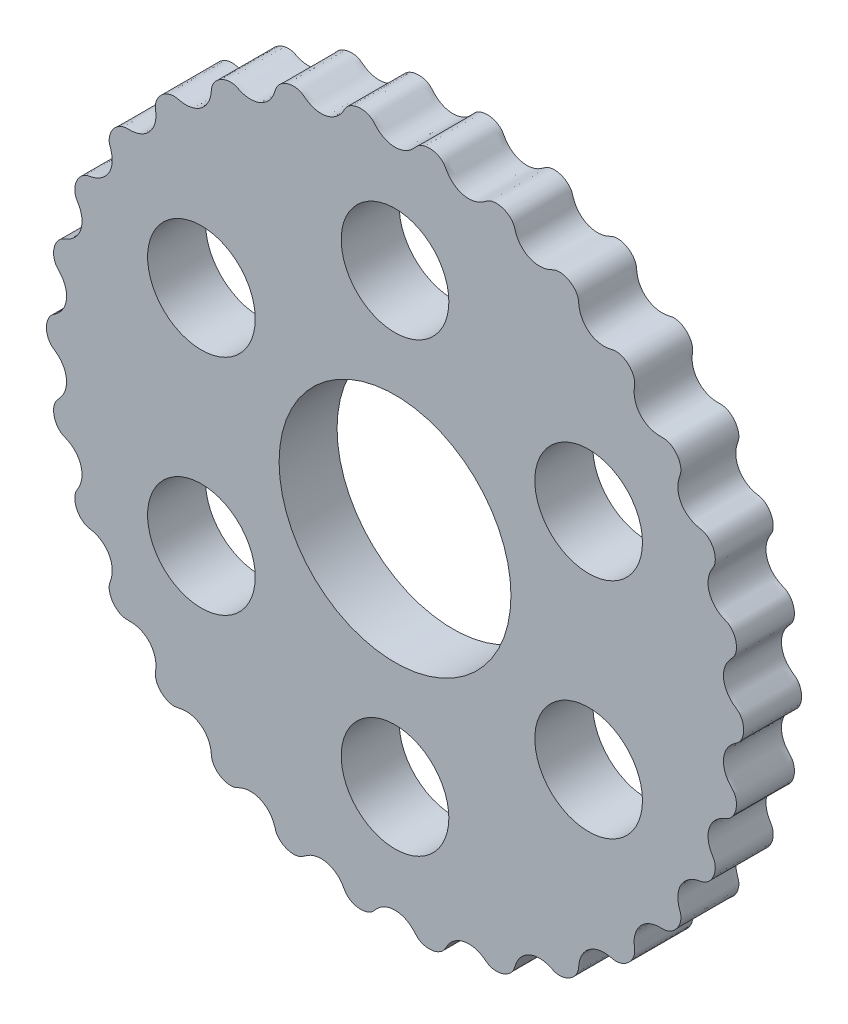
from build123d import *

# Parameters (mm, degrees)
BOSS_EXTRUDE1_DEPTH = 7
SKETCH2_R           = 14
SKETCH2_R_2         = 6.5
CUT_EXTRUDE1_DEPTH  = 7


with BuildPart() as part:
    # Sketch1 → Boss-Extrude1 (new body)
    with BuildSketch(Plane.XY):
        with BuildLine():
            add(Edge.make_bspline(
                [(0, 39.9), (-0.645065656, 39.9), (-1.539322366, 40.21259767), (-2.250661944, 40.881063376), (-2.506109766, 41.17643793), (-2.635737516, 41.318729318), (-2.747665644, 41.423428715), (-2.879288756, 41.524641158), (-3.046510521, 41.62716893), (-3.25481797, 41.724783596), (-3.502815797, 41.807416311), (-3.783910569, 41.864978672), (-4.087704244, 41.889350868), (-4.401331857, 41.875849776), (-4.710909524, 41.823849264), (-5.002990698, 41.736835229), (-5.265981079, 41.622111101), (-5.491369264, 41.489704359), (-5.674838528, 41.350927505), (-5.817080557, 41.215861536), (-5.924804258, 41.089510725), (-6.012501742, 40.963814005), (-6.109722065, 40.797685857), (-6.298161469, 40.455643023), (-6.855003789, 39.653906965), (-8.248790197, 38.807526858), (-9.866354979, 39.013810855), (-10.701125029, 39.519783186), (-11.012414893, 39.755581009), (-11.168788294, 39.867822582), (-11.300041805, 39.946952834), (-11.449825439, 40.018597491), (-11.634718196, 40.08410004), (-11.858762801, 40.136290095), (-12.118524387, 40.165548674), (-12.405441516, 40.163402985), (-12.707664161, 40.124080566), (-13.011633568, 40.045683329), (-13.303626541, 39.930433411), (-13.571245435, 39.784614233), (-13.804635676, 39.61771081), (-13.997570247, 39.441334708), (-14.148176904, 39.267447692), (-14.259219074, 39.105753536), (-14.338320877, 38.959771144), (-14.397972865, 38.818590868), (-14.458517255, 38.635876054), (-14.57173638, 38.262133975), (-14.949697776, 37.36213283), (-16.137075297, 36.244458295), (-17.76217422, 36.10994728), (-18.683914445, 36.431272599), (-19.037415713, 36.597220052), (-19.213710091, 36.674489778), (-19.358545148, 36.724616417), (-19.519957346, 36.763524699), (-19.71442148, 36.789181202), (-19.944421065, 36.793628474), (-20.204591891, 36.768266877), (-20.484792947, 36.70649882), (-20.772236961, 36.605206851), (-21.053257479, 36.465313517), (-21.31491952, 36.291891843), (-21.546358803, 36.093599466), (-21.739952457, 35.881824514), (-21.892011309, 35.669193988), (-22.003164368, 35.467784778), (-22.078160592, 35.286535354), (-22.125185799, 35.127300283), (-22.154176886, 34.976803786), (-22.17541159, 34.785496216), (-22.208458239, 34.396382144), (-22.391041383, 33.437469624), (-23.320088647, 32.097352524), (-24.881705606, 31.627887621), (-25.850108758, 31.750561808), (-26.230388037, 31.839381536), (-26.418897116, 31.878307067), (-26.570988313, 31.897225393), (-26.736963698, 31.901726756), (-26.932514543, 31.886390909), (-27.158416502, 31.842923227), (-27.40762672, 31.764018058), (-27.668861974, 31.645343711), (-27.928964765, 31.486505932), (-28.17476468, 31.291242907), (-28.394641964, 31.067196932), (-28.579812316, 30.825131227), (-28.725129872, 30.577727341), (-28.829660806, 30.338134924), (-28.896505906, 30.118017319), (-28.932194019, 29.92513997), (-28.945063874, 29.759600758), (-28.942139417, 29.606365185), (-28.923140382, 29.414820972), (-28.874558569, 29.027342423), (-28.853778643, 28.051420212), (-29.483904149, 26.547423861), (-30.913792841, 25.763558971), (-31.886537493, 25.68219601), (-32.276973695, 25.690019263), (-32.469455966, 25.688883899), (-32.622158066, 25.675777245), (-32.785443032, 25.645672193), (-32.973532589, 25.590018321), (-33.185456683, 25.500526365), (-33.41281234, 25.371528105), (-33.643672432, 25.201144828), (-33.865053016, 24.991683872), (-34.064895261, 24.749594568), (-34.233390476, 24.4847284), (-34.36417867, 24.209449928), (-34.454885235, 23.937239412), (-34.507315294, 23.68114744), (-34.526932968, 23.451941305), (-34.521734957, 23.255858581), (-34.499918722, 23.091263998), (-34.465198505, 22.941982769), (-34.406781509, 22.75857723), (-34.278702887, 22.389660541), (-34.055485298, 21.439387314), (-34.359122718, 19.837251543), (-35.594791887, 18.773218529), (-36.529367172, 18.491399145), (-36.912896703, 18.417864829), (-37.100941286, 18.376749821), (-37.247578485, 18.332169721), (-37.401037783, 18.268778664), (-37.573446012, 18.175233002), (-37.762127708, 18.043627929), (-37.957703107, 17.870186636), (-38.148086637, 17.655523843), (-38.321089599, 17.404619687), (-38.466210859, 17.126261707), (-38.575970714, 16.832159585), (-38.646654148, 16.535702104), (-38.678801265, 16.25058074), (-38.676823391, 15.989183384), (-38.64836856, 15.760907687), (-38.602526294, 15.570187116), (-38.546950564, 15.413728356), (-38.481960422, 15.274925823), (-38.386679186, 15.107678383), (-38.1847142, 14.773446158), (-37.768761219, 13.890363272), (-37.732713418, 12.260095212), (-38.720133718, 10.962403061), (-39.575691635, 10.492428495), (-39.935552945, 10.340764095), (-40.110936347, 10.261447836), (-40.245105829, 10.187368091), (-40.382020554, 10.093442657), (-40.531222943, 9.966108479), (-40.688414586, 9.798142648), (-40.843653797, 9.58782746), (-40.985249194, 9.338272015), (-41.102315758, 9.056884351), (-41.186379539, 8.754433457), (-41.232599694, 8.443939281), (-41.240099192, 8.139263057), (-41.212255262, 7.853692856), (-41.155988443, 7.598417652), (-41.080689119, 7.381046104), (-40.996194035, 7.204027919), (-40.90930649, 7.062538221), (-40.816874645, 6.940283846), (-40.688900553, 6.79650201), (-40.421864174, 6.511558246), (-39.831391771, 5.734262977), (-39.457164103, 4.147109167), (-40.153224222, 2.672487162), (-40.892366308, 2.034896764), (-41.212828887, 1.81172449), (-41.367887329, 1.697678155), (-41.483730579, 1.597327166), (-41.598119933, 1.476979031), (-41.717587823, 1.32140594), (-41.836424033, 1.12443269), (-41.944548556, 0.886440322), (-42.031163077, 0.612898322), (-42.087153039, 0.313316383), (-42.106518845, 0), (-42.087153039, -0.313316383), (-42.031163077, -0.612898322), (-41.944548556, -0.886440322), (-41.836424033, -1.12443269), (-41.717587823, -1.32140594), (-41.598119933, -1.476979031), (-41.483730579, -1.597327166), (-41.367887329, -1.697678155), (-41.212828887, -1.81172449), (-40.892366308, -2.034896764), (-40.153224222, -2.672487162), (-39.457164103, -4.147109167), (-39.831391771, -5.734262977), (-40.421864174, -6.511558246), (-40.688900553, -6.79650201), (-40.816874645, -6.940283846), (-40.90930649, -7.062538221), (-40.996194035, -7.204027919), (-41.080689119, -7.381046104), (-41.155988443, -7.598417652), (-41.212255262, -7.853692856), (-41.240099192, -8.139263057), (-41.232599694, -8.443939281), (-41.186379539, -8.754433457), (-41.102315758, -9.056884351), (-40.985249194, -9.338272015), (-40.843653797, -9.58782746), (-40.688414586, -9.798142648), (-40.531222943, -9.966108479), (-40.382020554, -10.093442657), (-40.245105829, -10.187368091), (-40.110936347, -10.261447836), (-39.935552945, -10.340764095), (-39.575691635, -10.492428495), (-38.720133718, -10.962403061), (-37.732713418, -12.260095212), (-37.768761219, -13.890363272), (-38.1847142, -14.773446158), (-38.386679186, -15.107678383), (-38.481960422, -15.274925823), (-38.546950564, -15.413728356), (-38.602526294, -15.570187116), (-38.64836856, -15.760907687), (-38.676823391, -15.989183384), (-38.678801265, -16.25058074), (-38.646654148, -16.535702104), (-38.575970714, -16.832159585), (-38.466210859, -17.126261707), (-38.321089599, -17.404619687), (-38.148086637, -17.655523843), (-37.957703107, -17.870186636), (-37.762127708, -18.043627929), (-37.573446012, -18.175233002), (-37.401037783, -18.268778664), (-37.247578485, -18.332169721), (-37.100941286, -18.376749821), (-36.912896703, -18.417864829), (-36.529367172, -18.491399145), (-35.594791887, -18.773218529), (-34.359122718, -19.837251543), (-34.055485298, -21.439387314), (-34.278702887, -22.389660541), (-34.406781509, -22.75857723), (-34.465198505, -22.941982769), (-34.499918722, -23.091263998), (-34.521734957, -23.255858581), (-34.526932968, -23.451941305), (-34.507315294, -23.68114744), (-34.454885235, -23.937239412), (-34.36417867, -24.209449928), (-34.233390476, -24.4847284), (-34.064895261, -24.749594568), (-33.865053016, -24.991683872), (-33.643672432, -25.201144828), (-33.41281234, -25.371528105), (-33.185456683, -25.500526365), (-32.973532589, -25.590018321), (-32.785443032, -25.645672193), (-32.622158066, -25.675777245), (-32.469455966, -25.688883899), (-32.276973695, -25.690019263), (-31.886537493, -25.68219601), (-30.913792841, -25.763558971), (-29.483904149, -26.547423861), (-28.853778643, -28.051420212), (-28.874558569, -29.027342423), (-28.923140382, -29.414820972), (-28.942139417, -29.606365185), (-28.945063874, -29.759600758), (-28.932194019, -29.92513997), (-28.896505906, -30.118017319), (-28.829660806, -30.338134924), (-28.725129872, -30.577727341), (-28.579812316, -30.825131227), (-28.394641964, -31.067196932), (-28.17476468, -31.291242907), (-27.928964765, -31.486505932), (-27.668861974, -31.645343711), (-27.40762672, -31.764018058), (-27.158416502, -31.842923227), (-26.932514543, -31.886390909), (-26.736963698, -31.901726756), (-26.570988313, -31.897225393), (-26.418897116, -31.878307067), (-26.230388037, -31.839381536), (-25.850108758, -31.750561808), (-24.881705606, -31.627887621), (-23.320088647, -32.097352524), (-22.391041383, -33.437469624), (-22.208458239, -34.396382144), (-22.17541159, -34.785496216), (-22.154176886, -34.976803786), (-22.125185799, -35.127300283), (-22.078160592, -35.286535354), (-22.003164368, -35.467784778), (-21.892011309, -35.669193988), (-21.739952457, -35.881824514), (-21.546358803, -36.093599466), (-21.31491952, -36.291891843), (-21.053257479, -36.465313517), (-20.772236961, -36.605206851), (-20.484792947, -36.70649882), (-20.204591891, -36.768266877), (-19.944421065, -36.793628474), (-19.71442148, -36.789181202), (-19.519957346, -36.763524699), (-19.358545148, -36.724616417), (-19.213710091, -36.674489778), (-19.037415713, -36.597220052), (-18.683914445, -36.431272599), (-17.76217422, -36.10994728), (-16.137075297, -36.244458295), (-14.949697776, -37.36213283), (-14.57173638, -38.262133975), (-14.458517255, -38.635876054), (-14.397972865, -38.818590868), (-14.338320877, -38.959771144), (-14.259219074, -39.105753536), (-14.148176904, -39.267447692), (-13.997570247, -39.441334708), (-13.804635676, -39.61771081), (-13.571245435, -39.784614233), (-13.303626541, -39.930433411), (-13.011633568, -40.045683329), (-12.707664161, -40.124080566), (-12.405441516, -40.163402985), (-12.118524387, -40.165548674), (-11.858762801, -40.136290095), (-11.634718196, -40.08410004), (-11.449825439, -40.018597491), (-11.300041805, -39.946952834), (-11.168788294, -39.867822582), (-11.012414893, -39.755581009), (-10.701125029, -39.519783186), (-9.866354979, -39.013810855), (-8.248790197, -38.807526858), (-6.855003789, -39.653906965), (-6.298161469, -40.455643023), (-6.109722065, -40.797685857), (-6.012501742, -40.963814005), (-5.924804258, -41.089510725), (-5.817080557, -41.215861536), (-5.674838528, -41.350927505), (-5.491369264, -41.489704359), (-5.265981079, -41.622111101), (-5.002990698, -41.736835229), (-4.710909524, -41.823849264), (-4.401331857, -41.875849776), (-4.087704244, -41.889350868), (-3.783910569, -41.864978672), (-3.502815797, -41.807416311), (-3.25481797, -41.724783596), (-3.046510521, -41.62716893), (-2.879288756, -41.524641158), (-2.747665644, -41.423428715), (-2.635737516, -41.318729318), (-2.506109766, -41.17643793), (-2.250661944, -40.881063376), (-1.539322366, -40.21259767), (0, -39.674509916), (1.539322366, -40.21259767), (2.250661944, -40.881063376), (2.506109766, -41.17643793), (2.635737516, -41.318729318), (2.747665644, -41.423428715), (2.879288756, -41.524641158), (3.046510521, -41.62716893), (3.25481797, -41.724783596), (3.502815797, -41.807416311), (3.783910569, -41.864978672), (4.087704244, -41.889350868), (4.401331857, -41.875849776), (4.710909524, -41.823849264), (5.002990698, -41.736835229), (5.265981079, -41.622111101), (5.491369264, -41.489704359), (5.674838528, -41.350927505), (5.817080557, -41.215861536), (5.924804258, -41.089510725), (6.012501742, -40.963814005), (6.109722065, -40.797685857), (6.298161469, -40.455643023), (6.855003789, -39.653906965), (8.248790197, -38.807526858), (9.866354979, -39.013810855), (10.701125029, -39.519783186), (11.012414893, -39.755581009), (11.168788294, -39.867822582), (11.300041805, -39.946952834), (11.449825439, -40.018597491), (11.634718196, -40.08410004), (11.858762801, -40.136290095), (12.118524387, -40.165548674), (12.405441516, -40.163402985), (12.707664161, -40.124080566), (13.011633568, -40.045683329), (13.303626541, -39.930433411), (13.571245435, -39.784614233), (13.804635676, -39.61771081), (13.997570247, -39.441334708), (14.148176904, -39.267447692), (14.259219074, -39.105753536), (14.338320877, -38.959771144), (14.397972865, -38.818590868), (14.458517255, -38.635876054), (14.57173638, -38.262133975), (14.949697776, -37.36213283), (16.137075297, -36.244458295), (17.76217422, -36.10994728), (18.683914445, -36.431272599), (19.037415713, -36.597220052), (19.213710091, -36.674489778), (19.358545148, -36.724616417), (19.519957346, -36.763524699), (19.71442148, -36.789181202), (19.944421065, -36.793628474), (20.204591891, -36.768266877), (20.484792947, -36.70649882), (20.772236961, -36.605206851), (21.053257479, -36.465313517), (21.31491952, -36.291891843), (21.546358803, -36.093599466), (21.739952457, -35.881824514), (21.892011309, -35.669193988), (22.003164368, -35.467784778), (22.078160592, -35.286535354), (22.125185799, -35.127300283), (22.154176886, -34.976803786), (22.17541159, -34.785496216), (22.208458239, -34.396382144), (22.391041383, -33.437469624), (23.320088647, -32.097352524), (24.881705606, -31.627887621), (25.850108758, -31.750561808), (26.230388037, -31.839381536), (26.418897116, -31.878307067), (26.570988313, -31.897225393), (26.736963698, -31.901726756), (26.932514543, -31.886390909), (27.158416502, -31.842923227), (27.40762672, -31.764018058), (27.668861974, -31.645343711), (27.928964765, -31.486505932), (28.17476468, -31.291242907), (28.394641964, -31.067196932), (28.579812316, -30.825131227), (28.725129872, -30.577727341), (28.829660806, -30.338134924), (28.896505906, -30.118017319), (28.932194019, -29.92513997), (28.945063874, -29.759600758), (28.942139417, -29.606365185), (28.923140382, -29.414820972), (28.874558569, -29.027342423), (28.853778643, -28.051420212), (29.483904149, -26.547423861), (30.913792841, -25.763558971), (31.886537493, -25.68219601), (32.276973695, -25.690019263), (32.469455966, -25.688883899), (32.622158066, -25.675777245), (32.785443032, -25.645672193), (32.973532589, -25.590018321), (33.185456683, -25.500526365), (33.41281234, -25.371528105), (33.643672432, -25.201144828), (33.865053016, -24.991683872), (34.064895261, -24.749594568), (34.233390476, -24.4847284), (34.36417867, -24.209449928), (34.454885235, -23.937239412), (34.507315294, -23.68114744), (34.526932968, -23.451941305), (34.521734957, -23.255858581), (34.499918722, -23.091263998), (34.465198505, -22.941982769), (34.406781509, -22.75857723), (34.278702887, -22.389660541), (34.055485298, -21.439387314), (34.359122718, -19.837251543), (35.594791887, -18.773218529), (36.529367172, -18.491399145), (36.912896703, -18.417864829), (37.100941286, -18.376749821), (37.247578485, -18.332169721), (37.401037783, -18.268778664), (37.573446012, -18.175233002), (37.762127708, -18.043627929), (37.957703107, -17.870186636), (38.148086637, -17.655523843), (38.321089599, -17.404619687), (38.466210859, -17.126261707), (38.575970714, -16.832159585), (38.646654148, -16.535702104), (38.678801265, -16.25058074), (38.676823391, -15.989183384), (38.64836856, -15.760907687), (38.602526294, -15.570187116), (38.546950564, -15.413728356), (38.481960422, -15.274925823), (38.386679186, -15.107678383), (38.1847142, -14.773446158), (37.768761219, -13.890363272), (37.732713418, -12.260095212), (38.720133718, -10.962403061), (39.575691635, -10.492428495), (39.935552945, -10.340764095), (40.110936347, -10.261447836), (40.245105829, -10.187368091), (40.382020554, -10.093442657), (40.531222943, -9.966108479), (40.688414586, -9.798142648), (40.843653797, -9.58782746), (40.985249194, -9.338272015), (41.102315758, -9.056884351), (41.186379539, -8.754433457), (41.232599694, -8.443939281), (41.240099192, -8.139263057), (41.212255262, -7.853692856), (41.155988443, -7.598417652), (41.080689119, -7.381046104), (40.996194035, -7.204027919), (40.90930649, -7.062538221), (40.816874645, -6.940283846), (40.688900553, -6.79650201), (40.421864174, -6.511558246), (39.831391771, -5.734262977), (39.457164103, -4.147109167), (40.153224222, -2.672487162), (40.892366308, -2.034896764), (41.212828887, -1.81172449), (41.367887329, -1.697678155), (41.483730579, -1.597327166), (41.598119933, -1.476979031), (41.717587823, -1.32140594), (41.836424033, -1.12443269), (41.944548556, -0.886440322), (42.031163077, -0.612898322), (42.087153039, -0.313316383), (42.106518845, 0), (42.087153039, 0.313316383), (42.031163077, 0.612898322), (41.944548556, 0.886440322), (41.836424033, 1.12443269), (41.717587823, 1.32140594), (41.598119933, 1.476979031), (41.483730579, 1.597327166), (41.367887329, 1.697678155), (41.212828887, 1.81172449), (40.892366308, 2.034896764), (40.153224222, 2.672487162), (39.457164103, 4.147109167), (39.831391771, 5.734262977), (40.421864174, 6.511558246), (40.688900553, 6.79650201), (40.816874645, 6.940283846), (40.90930649, 7.062538221), (40.996194035, 7.204027919), (41.080689119, 7.381046104), (41.155988443, 7.598417652), (41.212255262, 7.853692856), (41.240099192, 8.139263057), (41.232599694, 8.443939281), (41.186379539, 8.754433457), (41.102315758, 9.056884351), (40.985249194, 9.338272015), (40.843653797, 9.58782746), (40.688414586, 9.798142648), (40.531222943, 9.966108479), (40.382020554, 10.093442657), (40.245105829, 10.187368091), (40.110936347, 10.261447836), (39.935552945, 10.340764095), (39.575691635, 10.492428495), (38.720133718, 10.962403061), (37.732713418, 12.260095212), (37.768761219, 13.890363272), (38.1847142, 14.773446158), (38.386679186, 15.107678383), (38.481960422, 15.274925823), (38.546950564, 15.413728356), (38.602526294, 15.570187116), (38.64836856, 15.760907687), (38.676823391, 15.989183384), (38.678801265, 16.25058074), (38.646654148, 16.535702104), (38.575970714, 16.832159585), (38.466210859, 17.126261707), (38.321089599, 17.404619687), (38.148086637, 17.655523843), (37.957703107, 17.870186636), (37.762127708, 18.043627929), (37.573446012, 18.175233002), (37.401037783, 18.268778664), (37.247578485, 18.332169721), (37.100941286, 18.376749821), (36.912896703, 18.417864829), (36.529367172, 18.491399145), (35.594791887, 18.773218529), (34.359122718, 19.837251543), (34.055485298, 21.439387314), (34.278702887, 22.389660541), (34.406781509, 22.75857723), (34.465198505, 22.941982769), (34.499918722, 23.091263998), (34.521734957, 23.255858581), (34.526932968, 23.451941305), (34.507315294, 23.68114744), (34.454885235, 23.937239412), (34.36417867, 24.209449928), (34.233390476, 24.4847284), (34.064895261, 24.749594568), (33.865053016, 24.991683872), (33.643672432, 25.201144828), (33.41281234, 25.371528105), (33.185456683, 25.500526365), (32.973532589, 25.590018321), (32.785443032, 25.645672193), (32.622158066, 25.675777245), (32.469455966, 25.688883899), (32.276973695, 25.690019263), (31.886537493, 25.68219601), (30.913792841, 25.763558971), (29.483904149, 26.547423861), (28.853778643, 28.051420212), (28.874558569, 29.027342423), (28.923140382, 29.414820972), (28.942139417, 29.606365185), (28.945063874, 29.759600758), (28.932194019, 29.92513997), (28.896505906, 30.118017319), (28.829660806, 30.338134924), (28.725129872, 30.577727341), (28.579812316, 30.825131227), (28.394641964, 31.067196932), (28.17476468, 31.291242907), (27.928964765, 31.486505932), (27.668861974, 31.645343711), (27.40762672, 31.764018058), (27.158416502, 31.842923227), (26.932514543, 31.886390909), (26.736963698, 31.901726756), (26.570988313, 31.897225393), (26.418897116, 31.878307067), (26.230388037, 31.839381536), (25.850108758, 31.750561808), (24.881705606, 31.627887621), (23.320088647, 32.097352524), (22.391041383, 33.437469624), (22.208458239, 34.396382144), (22.17541159, 34.785496216), (22.154176886, 34.976803786), (22.125185799, 35.127300283), (22.078160592, 35.286535354), (22.003164368, 35.467784778), (21.892011309, 35.669193988), (21.739952457, 35.881824514), (21.546358803, 36.093599466), (21.31491952, 36.291891843), (21.053257479, 36.465313517), (20.772236961, 36.605206851), (20.484792947, 36.70649882), (20.204591891, 36.768266877), (19.944421065, 36.793628474), (19.71442148, 36.789181202), (19.519957346, 36.763524699), (19.358545148, 36.724616417), (19.213710091, 36.674489778), (19.037415713, 36.597220052), (18.683914445, 36.431272599), (17.76217422, 36.10994728), (16.137075297, 36.244458295), (14.949697776, 37.36213283), (14.57173638, 38.262133975), (14.458517255, 38.635876054), (14.397972865, 38.818590868), (14.338320877, 38.959771144), (14.259219074, 39.105753536), (14.148176904, 39.267447692), (13.997570247, 39.441334708), (13.804635676, 39.61771081), (13.571245435, 39.784614233), (13.303626541, 39.930433411), (13.011633568, 40.045683329), (12.707664161, 40.124080566), (12.405441516, 40.163402985), (12.118524387, 40.165548674), (11.858762801, 40.136290095), (11.634718196, 40.08410004), (11.449825439, 40.018597491), (11.300041805, 39.946952834), (11.168788294, 39.867822582), (11.012414893, 39.755581009), (10.701125029, 39.519783186), (9.866354979, 39.013810855), (8.248790197, 38.807526858), (6.855003789, 39.653906965), (6.298161469, 40.455643023), (6.109722065, 40.797685857), (6.012501742, 40.963814005), (5.924804258, 41.089510725), (5.817080557, 41.215861536), (5.674838528, 41.350927505), (5.491369264, 41.489704359), (5.265981079, 41.622111101), (5.002990698, 41.736835229), (4.710909524, 41.823849264), (4.401331857, 41.875849776), (4.087704244, 41.889350868), (3.783910569, 41.864978672), (3.502815797, 41.807416311), (3.25481797, 41.724783596), (3.046510521, 41.62716893), (2.879288756, 41.524641158), (2.747665644, 41.423428715), (2.635737516, 41.318729318), (2.506109766, 41.17643793), (2.250661944, 40.881063376), (1.539322366, 40.21259767), (0.645065656, 39.9), (0, 39.9)],
                knots=[0, 0, 0, 0, 0.006371359, 0.008832637, 0.00976874, 0.010294619, 0.010765553, 0.011306507, 0.011959876, 0.012732252, 0.013612556, 0.014579861, 0.015607782, 0.016666672, 0.017725572, 0.018753447, 0.019720772, 0.020601057, 0.021373441, 0.022026805, 0.022567777, 0.023038705, 0.023564588, 0.024500704, 0.026961993, 0.033333337, 0.039704665, 0.042165947, 0.043102088, 0.043627959, 0.044098875, 0.044639831, 0.045293199, 0.046065595, 0.046945871, 0.047913193, 0.048941099, 0.049999998, 0.051058877, 0.052086769, 0.053054108, 0.05393439, 0.054706786, 0.055360116, 0.055901105, 0.056372025, 0.056897887, 0.05783403, 0.060295305, 0.066666665, 0.073038032, 0.075499311, 0.076435428, 0.076961314, 0.077432232, 0.077973191, 0.078626546, 0.079398924, 0.080279219, 0.081246546, 0.082274451, 0.083333339, 0.084392221, 0.085420113, 0.086387457, 0.087267738, 0.088040147, 0.088693496, 0.089234469, 0.089705361, 0.090231249, 0.091167374, 0.093628642, 0.099999997, 0.106371359, 0.108832623, 0.109768753, 0.110294636, 0.110765558, 0.111306508, 0.111959878, 0.112732269, 0.113612569, 0.114579871, 0.115607791, 0.116666671, 0.117725579, 0.118753468, 0.119720785, 0.12060107, 0.121373459, 0.122026816, 0.122567782, 0.123038723, 0.123564575, 0.1245007, 0.126961979, 0.13333335, 0.139704692, 0.14216596, 0.143102098, 0.143627968, 0.144098895, 0.144639858, 0.145293214, 0.146065599, 0.146945904, 0.147913205, 0.148941103, 0.150000011, 0.151058905, 0.152086804, 0.153054125, 0.153934404, 0.154706808, 0.15536016, 0.155901124, 0.156372027, 0.156897938, 0.157834042, 0.160295333, 0.166666667, 0.173038006, 0.175499293, 0.176435429, 0.176961295, 0.177432237, 0.177973193, 0.178626542, 0.179398944, 0.180279245, 0.181246541, 0.182274434, 0.183333341, 0.184392231, 0.185420113, 0.186387447, 0.187267752, 0.188040123, 0.188693476, 0.189234471, 0.189705364, 0.190231239, 0.191167388, 0.193628643, 0.2, 0.206371362, 0.208832613, 0.209768758, 0.210294648, 0.21076554, 0.211306498, 0.211959877, 0.212732253, 0.213612563, 0.214579883, 0.215607766, 0.216666666, 0.21772557, 0.218753446, 0.219720774, 0.220601064, 0.221373435, 0.222026817, 0.222567762, 0.223038698, 0.223564575, 0.22450069, 0.226961982, 0.23333332, 0.239704679, 0.242165976, 0.243102077, 0.243627961, 0.244098888, 0.244639839, 0.245293217, 0.246065611, 0.246945877, 0.247913216, 0.248941118, 0.25, 0.251058882, 0.252086784, 0.253054123, 0.253934389, 0.254706783, 0.255360161, 0.255901112, 0.256372039, 0.256897923, 0.257834024, 0.260295321, 0.26666668, 0.273038018, 0.27549931, 0.276435425, 0.276961302, 0.277432238, 0.277973183, 0.278626565, 0.279398936, 0.280279226, 0.281246554, 0.28227443, 0.283333334, 0.284392234, 0.285420117, 0.286387437, 0.287267747, 0.288040123, 0.288693502, 0.28923446, 0.289705352, 0.290231242, 0.291167387, 0.293628638, 0.3, 0.306371357, 0.308832612, 0.309768761, 0.310294636, 0.310765529, 0.311306524, 0.311959877, 0.312732248, 0.313612553, 0.314579887, 0.315607769, 0.316666659, 0.317725566, 0.318753459, 0.319720755, 0.320601056, 0.321373458, 0.322026807, 0.322567763, 0.323038705, 0.323564571, 0.324500707, 0.326961994, 0.333333333, 0.339704667, 0.342165958, 0.343102062, 0.343627973, 0.344098876, 0.34463984, 0.345293192, 0.346065596, 0.346945875, 0.347913196, 0.348941095, 0.349999989, 0.351058897, 0.352086795, 0.353054096, 0.353934401, 0.354706786, 0.355360142, 0.355901105, 0.356372032, 0.356897902, 0.35783404, 0.360295308, 0.36666665, 0.373038021, 0.3754993, 0.376435425, 0.376961277, 0.377432218, 0.377973184, 0.378626541, 0.37939893, 0.380279215, 0.381246532, 0.382274421, 0.383333329, 0.384392209, 0.385420129, 0.386387431, 0.387267731, 0.388040122, 0.388693492, 0.389234442, 0.389705364, 0.390231247, 0.391167377, 0.393628641, 0.400000003, 0.406371358, 0.408832626, 0.409768751, 0.410294639, 0.410765531, 0.411306504, 0.411959853, 0.412732262, 0.413612543, 0.414579887, 0.415607779, 0.416666661, 0.417725549, 0.418753454, 0.419720781, 0.420601076, 0.421373454, 0.422026809, 0.422567768, 0.423038686, 0.423564572, 0.424500689, 0.426961968, 0.433333335, 0.439704695, 0.44216597, 0.443102113, 0.443627975, 0.444098895, 0.444639884, 0.445293214, 0.44606561, 0.446945892, 0.447913231, 0.448941123, 0.450000002, 0.451058901, 0.452086807, 0.453054129, 0.453934405, 0.454706801, 0.455360169, 0.455901125, 0.456372041, 0.456897912, 0.457834053, 0.460295335, 0.466666663, 0.473038007, 0.475499296, 0.476435412, 0.476961295, 0.477432223, 0.477973195, 0.478626559, 0.479398943, 0.480279228, 0.481246553, 0.482274428, 0.483333328, 0.484392218, 0.485420139, 0.486387444, 0.487267748, 0.488040124, 0.488693493, 0.489234447, 0.489705381, 0.49023126, 0.491167363, 0.493628641, 0.5, 0.506371359, 0.508832637, 0.50976874, 0.510294619, 0.510765553, 0.511306507, 0.511959876, 0.512732252, 0.513612556, 0.514579861, 0.515607782, 0.516666672, 0.517725572, 0.518753447, 0.519720772, 0.520601057, 0.521373441, 0.522026805, 0.522567777, 0.523038705, 0.523564588, 0.524500704, 0.526961993, 0.533333337, 0.539704665, 0.542165947, 0.543102088, 0.543627959, 0.544098875, 0.544639831, 0.545293199, 0.546065595, 0.546945871, 0.547913193, 0.548941099, 0.549999998, 0.551058877, 0.552086769, 0.553054108, 0.55393439, 0.554706786, 0.555360116, 0.555901105, 0.556372025, 0.556897887, 0.55783403, 0.560295305, 0.566666665, 0.573038032, 0.575499311, 0.576435428, 0.576961314, 0.577432232, 0.577973191, 0.578626546, 0.579398924, 0.580279219, 0.581246546, 0.582274451, 0.583333339, 0.584392221, 0.585420113, 0.586387457, 0.587267738, 0.588040147, 0.588693496, 0.589234469, 0.589705361, 0.590231249, 0.591167374, 0.593628642, 0.599999997, 0.606371359, 0.608832623, 0.609768753, 0.610294636, 0.610765558, 0.611306508, 0.611959878, 0.612732269, 0.613612569, 0.614579871, 0.615607791, 0.616666671, 0.617725579, 0.618753468, 0.619720785, 0.62060107, 0.621373459, 0.622026816, 0.622567782, 0.623038723, 0.623564575, 0.6245007, 0.626961979, 0.63333335, 0.639704692, 0.64216596, 0.643102098, 0.643627968, 0.644098895, 0.644639858, 0.645293214, 0.646065599, 0.646945904, 0.647913205, 0.648941103, 0.650000011, 0.651058905, 0.652086804, 0.653054125, 0.653934404, 0.654706808, 0.65536016, 0.655901124, 0.656372027, 0.656897938, 0.657834042, 0.660295333, 0.666666667, 0.673038006, 0.675499293, 0.676435429, 0.676961295, 0.677432237, 0.677973193, 0.678626542, 0.679398944, 0.680279245, 0.681246541, 0.682274434, 0.683333341, 0.684392231, 0.685420113, 0.686387447, 0.687267752, 0.688040123, 0.688693476, 0.689234471, 0.689705364, 0.690231239, 0.691167388, 0.693628643, 0.7, 0.706371362, 0.708832613, 0.709768758, 0.710294648, 0.71076554, 0.711306498, 0.711959877, 0.712732253, 0.713612563, 0.714579883, 0.715607766, 0.716666666, 0.71772557, 0.718753446, 0.719720774, 0.720601064, 0.721373435, 0.722026817, 0.722567762, 0.723038698, 0.723564575, 0.72450069, 0.726961982, 0.73333332, 0.739704679, 0.742165976, 0.743102077, 0.743627961, 0.744098888, 0.744639839, 0.745293217, 0.746065611, 0.746945877, 0.747913216, 0.748941118, 0.75, 0.751058882, 0.752086784, 0.753054123, 0.753934389, 0.754706783, 0.755360161, 0.755901112, 0.756372039, 0.756897923, 0.757834024, 0.760295321, 0.76666668, 0.773038018, 0.77549931, 0.776435425, 0.776961302, 0.777432238, 0.777973183, 0.778626565, 0.779398936, 0.780279226, 0.781246554, 0.78227443, 0.783333334, 0.784392234, 0.785420117, 0.786387437, 0.787267747, 0.788040123, 0.788693502, 0.78923446, 0.789705352, 0.790231242, 0.791167387, 0.793628638, 0.8, 0.806371357, 0.808832612, 0.809768761, 0.810294636, 0.810765529, 0.811306524, 0.811959877, 0.812732248, 0.813612553, 0.814579887, 0.815607769, 0.816666659, 0.817725566, 0.818753459, 0.819720755, 0.820601056, 0.821373458, 0.822026807, 0.822567763, 0.823038705, 0.823564571, 0.824500707, 0.826961994, 0.833333333, 0.839704667, 0.842165958, 0.843102062, 0.843627973, 0.844098876, 0.84463984, 0.845293192, 0.846065596, 0.846945875, 0.847913196, 0.848941095, 0.849999989, 0.851058897, 0.852086795, 0.853054096, 0.853934401, 0.854706786, 0.855360142, 0.855901105, 0.856372032, 0.856897902, 0.85783404, 0.860295308, 0.86666665, 0.873038021, 0.8754993, 0.876435425, 0.876961277, 0.877432218, 0.877973184, 0.878626541, 0.87939893, 0.880279215, 0.881246532, 0.882274421, 0.883333329, 0.884392209, 0.885420129, 0.886387431, 0.887267731, 0.888040122, 0.888693492, 0.889234442, 0.889705364, 0.890231247, 0.891167377, 0.893628641, 0.900000003, 0.906371358, 0.908832626, 0.909768751, 0.910294639, 0.910765531, 0.911306504, 0.911959853, 0.912732262, 0.913612543, 0.914579887, 0.915607779, 0.916666661, 0.917725549, 0.918753454, 0.919720781, 0.920601076, 0.921373454, 0.922026809, 0.922567768, 0.923038686, 0.923564572, 0.924500689, 0.926961968, 0.933333335, 0.939704695, 0.94216597, 0.943102113, 0.943627975, 0.944098895, 0.944639884, 0.945293214, 0.94606561, 0.946945892, 0.947913231, 0.948941123, 0.950000002, 0.951058901, 0.952086807, 0.953054129, 0.953934405, 0.954706801, 0.955360169, 0.955901125, 0.956372041, 0.956897912, 0.957834053, 0.960295335, 0.966666663, 0.973038007, 0.975499296, 0.976435412, 0.976961295, 0.977432223, 0.977973195, 0.978626559, 0.979398943, 0.980279228, 0.981246553, 0.982274428, 0.983333328, 0.984392218, 0.985420139, 0.986387444, 0.987267748, 0.988040124, 0.988693493, 0.989234447, 0.989705381, 0.99023126, 0.991167363, 0.993628641, 1, 1, 1, 1], degree=3))
        make_face()
    extrude(amount=BOSS_EXTRUDE1_DEPTH)

    # Sketch2 → Cut-Extrude1 (cut)
    with BuildSketch(Plane.XY.offset(7)):
        Circle(SKETCH2_R)
        with Locations((0, 27)):
            Circle(SKETCH2_R_2)
        with Locations((23.382685902, 13.5)):
            Circle(SKETCH2_R_2)
        with Locations((23.382685902, -13.5)):
            Circle(SKETCH2_R_2)
        with Locations((0, -27)):
            Circle(SKETCH2_R_2)
        with Locations((-23.382685902, -13.5)):
            Circle(SKETCH2_R_2)
        with Locations((-23.382685902, 13.5)):
            Circle(SKETCH2_R_2)
    extrude(amount=-CUT_EXTRUDE1_DEPTH, mode=Mode.SUBTRACT)


solid = part.part
